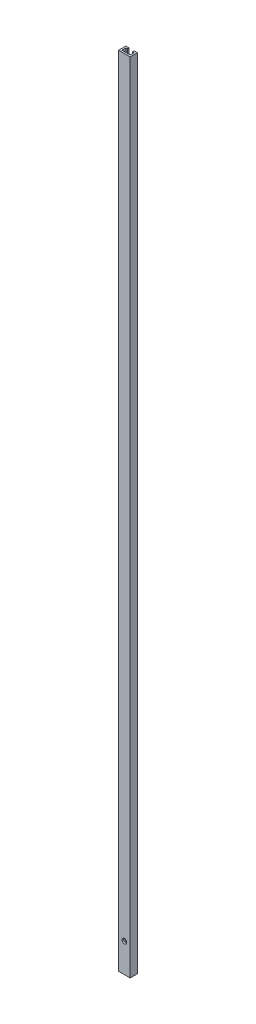
from build123d import *

# Parameters (mm, degrees)
EXTRUDE_1_DEPTH     = 550
SKETCH_2_R          = 1.6
CUT_EXTRUDE_1_DEPTH = 1.15


with BuildPart() as part:
    # 草图1 → 凸台-拉伸1 (new body)
    with BuildSketch(Plane(origin=(0, 0, 0), x_dir=(1, 0, 0), z_dir=(0, 1, 0))):
        Polygon((0, -5), (8, -5), (8, 0), (5.75, 0), (5.75, -1.15), (6.85, -1.15), (6.85, -3.85), (1.15, -3.85), (1.15, -1.15), (2.25, -1.15), (2.25, 0), (0, 0), align=None)
    extrude(amount=EXTRUDE_1_DEPTH)

    # 草图2 → 切除-拉伸1 (cut)
    with BuildSketch(Plane.XY.offset(5)):
        with Locations((4, 20)):
            Circle(SKETCH_2_R)
    extrude(amount=-CUT_EXTRUDE_1_DEPTH, mode=Mode.SUBTRACT)


solid = part.part
